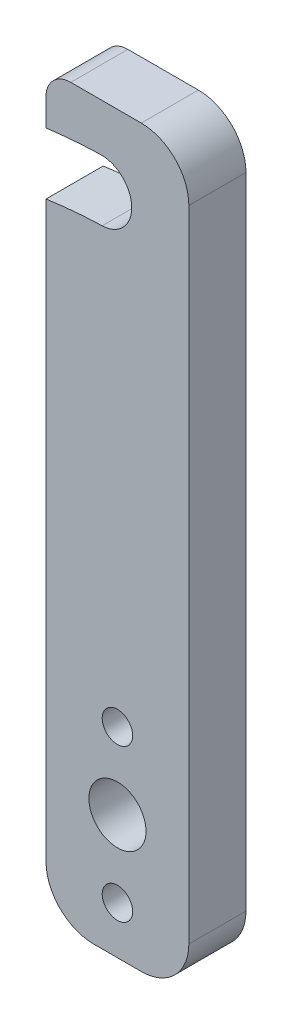
from build123d import *

# Parameters (mm, degrees)
ESBO_O1_R                = 1.6
ESBO_O1_R_2              = 3
RESSALTO_EXTRUS_O1_DEPTH = 6
FILETE1_R                = 5
FILETE2_R                = 2.6


with BuildPart() as part:
    # Esboço1 → Ressalto-extrusão1 (new body)
    with BuildSketch(Plane.XY):
        with BuildLine():
            Line((-7.5, 26.678233731), (-7.5, -38.58638145))
            Line((-7.5, -38.58638145), (7.5, -38.58638145))
            Line((7.5, -38.58638145), (7.5, 38.58638145))
            Line((7.5, 38.58638145), (-7.5, 38.58638145))
            Line((-7.5, 38.58638145), (-7.5, 33.136612343))
            ThreePointArc((-7.5, 33.136612343), (-4.653230591, 33.430458901), (-1.795586451, 33.58638145))
            ThreePointArc((-1.795586451, 33.58638145), (1.5, 30.484912453), (-1.601468997, 27.189326002))
            ThreePointArc((-1.601468997, 27.189326002), (-4.557903938, 27.016522573), (-7.5, 26.678233731))
        make_face()
        with Locations((0, -33.58638145)):
            Circle(ESBO_O1_R, mode=Mode.SUBTRACT)
        with Locations((0, -25.58638145)):
            Circle(ESBO_O1_R_2, mode=Mode.SUBTRACT)
        with Locations((0, -17.58638145)):
            Circle(ESBO_O1_R, mode=Mode.SUBTRACT)
    extrude(amount=RESSALTO_EXTRUS_O1_DEPTH)

    # Filete1
    filete1_edges = [part.edges().sort_by_distance(p)[0] for p in [
        (7.5, 38.58638145, 3),
        (7.5, -38.58638145, 3),
        (-7.5, -38.58638145, 3),
    ]]
    fillet(filete1_edges, radius=FILETE1_R)

    # Filete2
    filete2_edges = [part.edges().sort_by_distance(p)[0] for p in [
        (-7.5, 38.58638145, 3),
    ]]
    fillet(filete2_edges, radius=FILETE2_R)


solid = part.part
